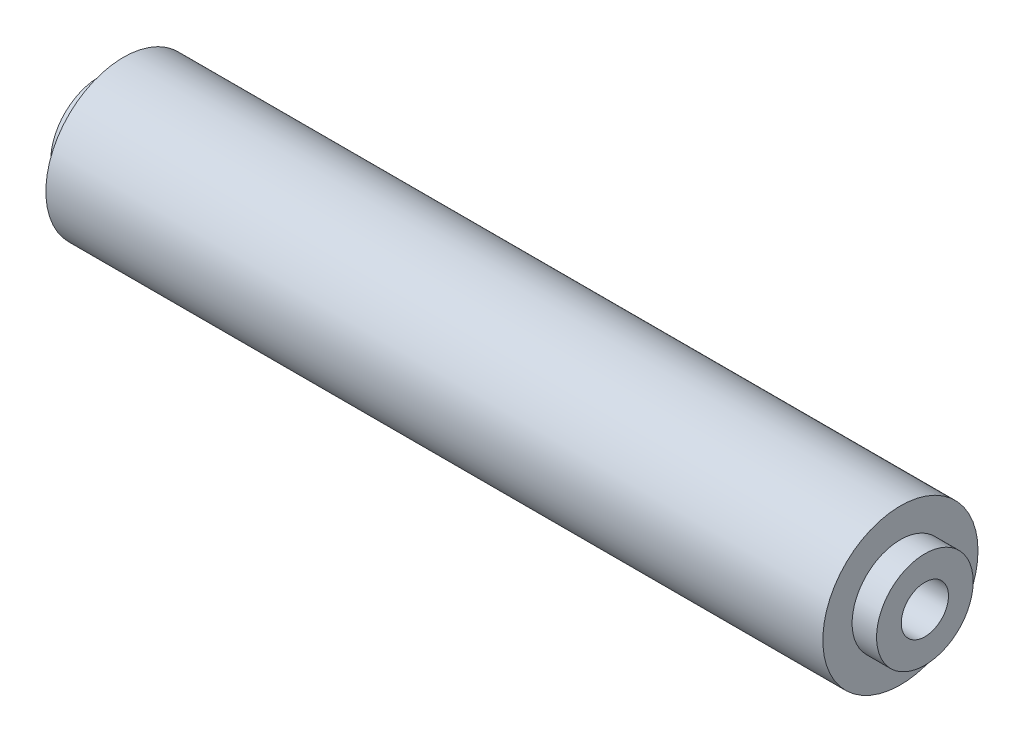
from build123d import *

# Parameters (mm, degrees)
SKETCH4_R           = 9.3853
SKETCH4_R_2         = 4.5847
BOSS_EXTRUDE1_DEPTH = 4.7498
SKETCH5_R           = 15.07617
BOSS_EXTRUDE2_DEPTH = 75.48314015
SKETCH6_R           = 4.5847
CUT_EXTRUDE1_DEPTH  = 158.168951984


with BuildPart() as part:
    # Sketch4 → Boss-Extrude1 (new body)
    with BuildSketch(Plane(origin=(0, 0, 0), x_dir=(0, 0, -1), z_dir=(1, 0, 0))):
        Circle(SKETCH4_R)
        Circle(SKETCH4_R_2, mode=Mode.SUBTRACT)
    boss_extrude1 = extrude(amount=BOSS_EXTRUDE1_DEPTH)

    # Sketch5 → Boss-Extrude2 (add)
    with BuildSketch(Plane(origin=(4.7498, 0, 0), x_dir=(0, 0, -1), z_dir=(1, 0, 0))):
        Circle(SKETCH5_R)
    boss_extrude2 = extrude(amount=BOSS_EXTRUDE2_DEPTH)

    # Mirror3: Boss-Extrude2 across plane
    add(boss_extrude2.mirror(Plane(origin=(80.23294015, 0, 0), x_dir=(0, 0, 1), z_dir=(1, 0, 0))))

    # Mirror4: Boss-Extrude1 across plane
    add(boss_extrude1.mirror(Plane(origin=(80.23294015, 0, 0), x_dir=(0, 0, 1), z_dir=(1, 0, 0))))

    # Sketch6 → Cut-Extrude1 (cut, through all)
    with BuildSketch(Plane(origin=(155.7160803, 0, 0), x_dir=(0, 0, -1), z_dir=(1, 0, 0))):
        Circle(SKETCH6_R)
    extrude(amount=-CUT_EXTRUDE1_DEPTH, mode=Mode.SUBTRACT)


solid = part.part
